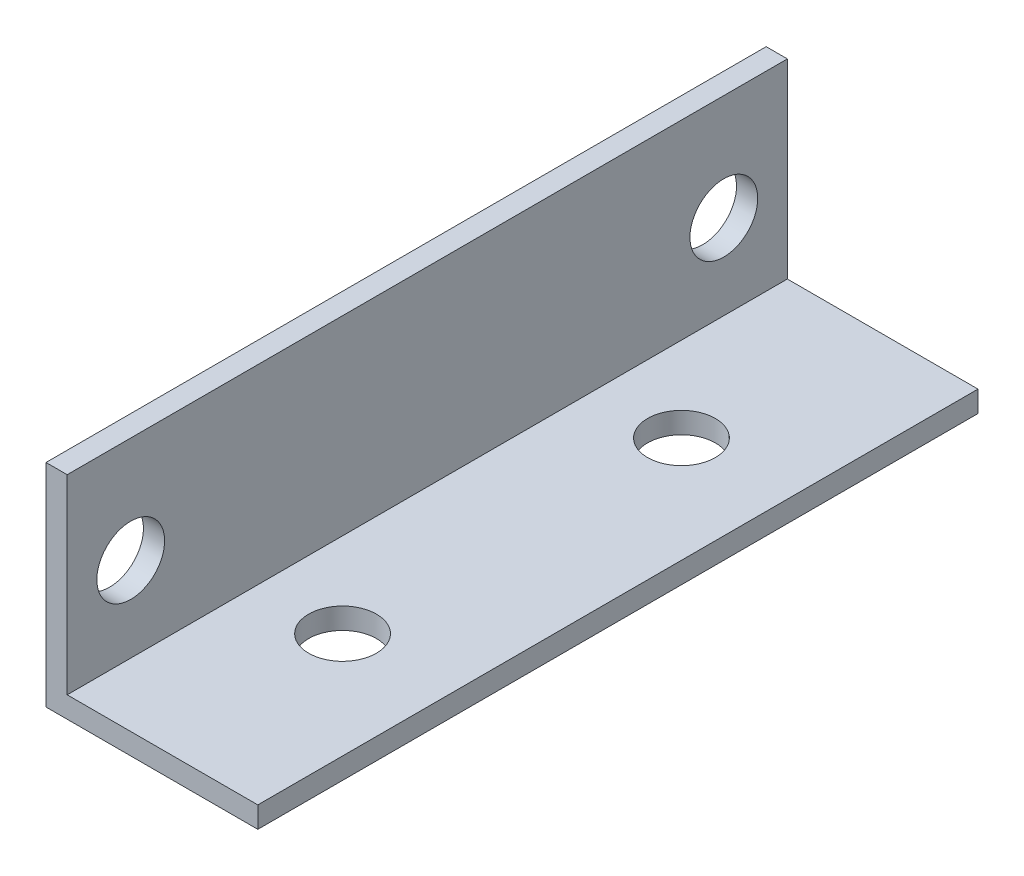
from build123d import *

# Parameters (mm, degrees)
EXTRUDE_1_DEPTH     = 17
SKETCH_2_R          = 1.6
CUT_EXTRUDE_1_DEPTH = 21.346989949
SKETCH_3_R          = 1.6
CUT_EXTRUDE_2_DEPTH = 21.346989949


with BuildPart() as part:
    # ｽｹｯﾁ1 → 押し出し-薄板1 (new, symmetric)
    with BuildSketch(Plane.XY):
        Polygon((5, -5), (-5, -5), (-5, 5), (-4, 5), (-4, -4), (5, -4), align=None)
    extrude(amount=EXTRUDE_1_DEPTH, both=True)

    # ｽｹｯﾁ2 → ｶｯﾄ - 押し出し1 (cut, through all)
    with BuildSketch(Plane.ZY.offset(5)):
        with Locations(Location((-14, 0, 0), (0, 0, 270))):
            Circle(SKETCH_2_R)
        with Locations(Location((14, 0, 0), (0, 0, 270))):
            Circle(SKETCH_2_R)
    extrude(amount=-CUT_EXTRUDE_1_DEPTH, mode=Mode.SUBTRACT)

    # ｽｹｯﾁ3 → ｶｯﾄ - 押し出し2 (cut, through all)
    with BuildSketch(Plane.XZ.offset(5)):
        with Locations((0, -8)):
            Circle(SKETCH_3_R)
        with Locations((0, 8)):
            Circle(SKETCH_3_R)
    extrude(amount=-CUT_EXTRUDE_2_DEPTH, mode=Mode.SUBTRACT)


solid = part.part
